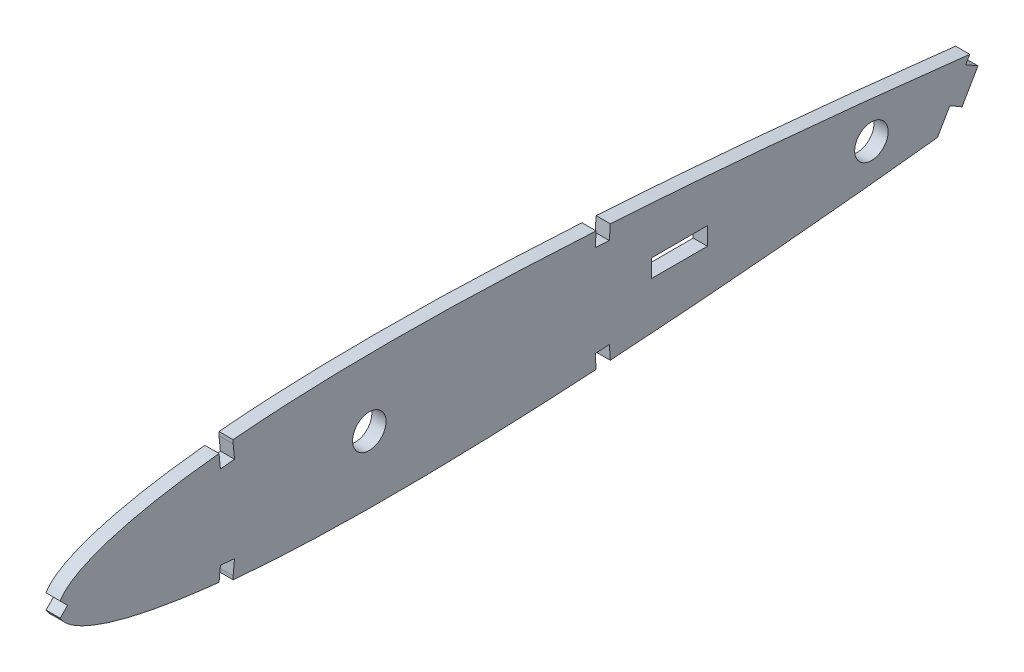
from build123d import *

# Parameters (mm, degrees)
MAIN_AIRFOIL_DEPTH               = 3.175
SPAR_HOLES_D                     = 7.5
LEADING_EDGE_SHEETING_DEPTH      = 251.46982022
LEADING_EDGE_SHEETING_DEPTH_BACK = 251.46982022
ENDPLATE_ELEVATOR_CUT_DEPTH      = 251.46982022
ENDPLATE_ELEVATOR_CUT_DEPTH_BACK = 251.46982022
STRINGERS_CUT_DEPTH              = 210.033152603
STRINGERS_CUT_DEPTH_BACK         = 210.033152603
SERVO_WIRE_CUT_DEPTH             = 208.449962387
SERVO_WIRE_CUT_DEPTH_BACK        = 208.449962387
SKETCH12_W                       = 12.5
SKETCH12_H                       = 4


with BuildPart() as part:
    # Sketch1 → main airfoil (new body)
    with BuildSketch(Plane(origin=(0, 0, 0), x_dir=(0, 0, -1), z_dir=(1, 0, 0))):
        with BuildLine():
            add(Edge.make_bspline(
                [(250, -2e-09), (250, 0.018678284), (249.174689323, 0.093287857), (248.32446246, 0.259458763), (246.243044417, 0.533840137), (243.659362537, 0.910573958), (240.240612473, 1.384241178), (236.150430611, 1.945886269), (231.361161707, 2.586906774), (225.920856641, 3.297863303), (219.856797124, 4.06796415), (213.208366153, 4.885916807), (206.016018791, 5.741913973), (198.324180408, 6.62406412), (190.180187635, 7.520784501), (181.634404857, 8.421582341), (172.739445771, 9.314517476), (163.550215709, 10.187513224), (154.123274492, 11.028891603), (144.516832181, 11.82466947), (134.789982601, 12.562946799), (125.002727118, 13.229618159), (115.215358592, 13.810721438), (105.48818759, 14.29294213), (95.881251181, 14.663216165), (86.453504035, 14.909617829), (77.263215674, 15.020341748), (68.366854268, 14.987626073), (59.81926941, 14.804121641), (51.673066268, 14.465801182), (43.978409925, 13.97145626), (36.782541712, 13.323205499), (30.129564021, 12.525445662), (24.059974529, 11.585520991), (18.610573434, 10.513116535), (13.813297521, 9.320389204), (9.695407656, 8.018962504), (6.277825273, 6.620958993), (3.57144917, 5.13583648), (1.580443808, 3.560663864), (0.305221072, 1.857334126), (-0.142243872, 0), (0.305221072, -1.857334126), (1.580443808, -3.560663864), (3.57144917, -5.13583648), (6.277825273, -6.620958993), (9.695407656, -8.018962504), (13.813297521, -9.320389204), (18.610573434, -10.513116535), (24.059974528, -11.585520991), (30.129564021, -12.525445662), (36.782541712, -13.3232055), (43.978409924, -13.97145626), (51.673066268, -14.465801183), (59.81926941, -14.804121642), (68.366854268, -14.987626074), (77.263215673, -15.020341748), (86.453504035, -14.90961783), (95.881251181, -14.663216166), (105.48818759, -14.292942132), (115.215358592, -13.810721439), (125.002727117, -13.229618161), (134.789982601, -12.562946801), (144.516832181, -11.824669472), (154.123274492, -11.028891605), (163.550215709, -10.187513226), (172.73944577, -9.314517478), (181.634404857, -8.421582343), (190.180187634, -7.520784503), (198.324180408, -6.624064123), (206.016018791, -5.741913976), (213.208366153, -4.88591681), (219.856797124, -4.067964152), (225.920856641, -3.297863306), (231.361161707, -2.586906777), (236.150430611, -1.945886272), (240.240612473, -1.384241181), (243.659362537, -0.910573961), (246.243044417, -0.53384014), (248.32446246, -0.259458766), (249.174689323, -0.09328786), (250, -0.018678287), (250, -2e-09)],
                knots=[0, 0, 0, 0, 0.000763607, 0.003050195, 0.006844435, 0.012122612, 0.018850497, 0.026986066, 0.036476947, 0.047263893, 0.059278171, 0.072445234, 0.086681978, 0.101899794, 0.118004328, 0.134894608, 0.152465716, 0.170609402, 0.189211673, 0.208158561, 0.227331554, 0.24661328, 0.265884303, 0.285025762, 0.303921916, 0.322456848, 0.340520504, 0.358003941, 0.374805255, 0.390827224, 0.405977835, 0.420173298, 0.433337329, 0.445401027, 0.456307113, 0.466008503, 0.474475471, 0.481698721, 0.48770537, 0.492584414, 0.496544073, 0.5, 0.503455927, 0.507415586, 0.51229463, 0.518301279, 0.525524529, 0.533991497, 0.543692887, 0.554598973, 0.566662671, 0.579826702, 0.594022165, 0.609172776, 0.625194745, 0.641996059, 0.659479496, 0.677543152, 0.696078084, 0.714974238, 0.734115697, 0.75338672, 0.772668446, 0.791841439, 0.810788327, 0.829390598, 0.847534284, 0.865105392, 0.881995672, 0.898100206, 0.913318022, 0.927554766, 0.940721829, 0.952736107, 0.963523053, 0.973013934, 0.981149503, 0.987877388, 0.993155565, 0.996949805, 0.999236393, 1, 1, 1, 1], degree=3))
        make_face()
    extrude(amount=MAIN_AIRFOIL_DEPTH)

    # spar holes (through all)
    with Locations(Plane(origin=(0, 0, 0), x_dir=(0, 0, -1), z_dir=(-1, 0, 0))):
        with Locations((70.5, 0), (183, 0)):
            Hole(SPAR_HOLES_D / 2)

    # Sketch6 → leading edge sheeting (cut, two sides: drawn at the far end of the back side and taken through both)
    with BuildSketch(Plane(origin=(0, 0, 0), x_dir=(0, 0, -1), z_dir=(1, 0, 0)).offset(-LEADING_EDGE_SHEETING_DEPTH_BACK)):
        with BuildLine():
            Line((40, 12.807355199), (40, 13.604416608))
            add(Edge.make_bspline(
                [(40, 13.604416608), (38.869847951, 13.500847876), (35.513913522, 13.171084048), (30.129564021, 12.525445662), (24.059974529, 11.585520991), (18.610573434, 10.513116535), (13.813297521, 9.320389204), (9.695407656, 8.018962504), (6.277825273, 6.620958993), (3.57144917, 5.13583648), (1.580443808, 3.560663864), (0.305221072, 1.857334126), (-0.142243872, 0), (0.305221072, -1.857334126), (1.580443808, -3.560663864), (3.57144917, -5.13583648), (6.277825273, -6.620958993), (9.695407656, -8.018962504), (13.813297521, -9.320389204), (18.610573434, -10.513116535), (24.059974528, -11.585520991), (30.129564021, -12.525445662), (35.513913522, -13.171084049), (38.869847951, -13.500847877), (40, -13.604416608)],
                knots=[0.413495277, 0.413495277, 0.413495277, 0.413495277, 0.420173298, 0.433337329, 0.445401027, 0.456307113, 0.466008503, 0.474475471, 0.481698721, 0.48770537, 0.492584414, 0.496544073, 0.5, 0.503455927, 0.507415586, 0.51229463, 0.518301279, 0.525524529, 0.533991497, 0.543692887, 0.554598973, 0.566662671, 0.579826702, 0.586504723, 0.586504723, 0.586504723, 0.586504723], degree=3))
            Line((40, -13.604416608), (40, -12.807355199))
            add(Edge.make_bspline(
                [(40, 12.807355199), (37.780060227, 12.603336944), (32.480475857, 12.046953916), (25.675735913, 11.073549093), (19.603802696, 9.905628586), (15.097706964, 8.844054398), (10.674365466, 7.532916953), (7.111963321, 6.138793478), (4.45362056, 4.719277098), (2.641930959, 3.442374832), (1.188772611, 1.866891991), (0.596238695, 0), (1.188772611, -1.866891991), (2.641930959, -3.442374832), (4.45362056, -4.719277098), (7.111963321, -6.138793478), (10.674365466, -7.532916953), (15.097706964, -8.844054398), (19.603802696, -9.905628586), (25.675735913, -11.073549093), (32.480475857, -12.046953916), (37.780060227, -12.603336944), (40, -12.807355199)],
                knots=[0.413638357, 0.413638357, 0.413638357, 0.413638357, 0.426796419, 0.445097314, 0.454247762, 0.46339821, 0.472548657, 0.481699105, 0.486274329, 0.490849552, 0.495424776, 0.5, 0.504575224, 0.509150448, 0.513725671, 0.518300895, 0.527451343, 0.53660179, 0.545752238, 0.554902686, 0.573203581, 0.586361643, 0.586361643, 0.586361643, 0.586361643], degree=3))
        make_face()
    extrude(amount=LEADING_EDGE_SHEETING_DEPTH + LEADING_EDGE_SHEETING_DEPTH_BACK, mode=Mode.SUBTRACT)

    # Sketch5 → endplate elevator cut (cut, two sides: drawn at the far end of the back side and taken through both)
    with BuildSketch(Plane(origin=(0, 0, 0), x_dir=(0, 0, -1), z_dir=(1, 0, 0)).offset(-ENDPLATE_ELEVATOR_CUT_DEPTH_BACK)):
        Polygon((209.150369343, 6.626585949), (201.726255621, -6.232356218), (201.726255621, -23.257370884), (308.705498093, -23.257370884), (308.705498093, 11.775498724), (209.150369343, 11.775498724), align=None)
    extrude(amount=ENDPLATE_ELEVATOR_CUT_DEPTH + ENDPLATE_ELEVATOR_CUT_DEPTH_BACK, mode=Mode.SUBTRACT)

    # Sketch7 → stringers cut (cut, two sides: drawn at the far end of the back side and taken through both)
    with BuildSketch(Plane(origin=(0, 0, 0), x_dir=(0, 0, -1), z_dir=(1, 0, 0)).offset(-STRINGERS_CUT_DEPTH_BACK)):
        Polygon((2.907690166, 0), (0.662626136, 2.24506403), (-1.582437894, 0), (0.662626136, -2.24506403), align=None)
        Polygon((40.310651703, 9.647589302), (39.689348297, 15.967121095), (36.529582401, 15.656469392), (37.150885807, 9.336937599), align=None)
        Polygon((37.150885807, -9.3369376), (36.529582401, -15.656469392), (39.689348297, -15.967121095), (40.310651703, -9.647589303), align=None)
        Polygon((121.517319666, 16.612805314), (121.125348927, 10.274914581), (124.294294293, 10.078929211), (124.686265033, 16.416819944), align=None)
        Polygon((207.307838534, 9.785228973), (204.132838534, 4.285967659), (206.882469191, 2.698467659), (210.057469191, 8.197728973), align=None)
        Polygon((200.564124964, -1.895225561), (197.389124964, -7.394486875), (200.138755621, -8.981986875), (203.313755621, -3.482725561), align=None)
        Polygon((121.125348927, -10.274914582), (121.517319666, -16.612805315), (124.686265033, -16.416819945), (124.294294293, -10.078929213), align=None)
    extrude(amount=STRINGERS_CUT_DEPTH + STRINGERS_CUT_DEPTH_BACK, mode=Mode.SUBTRACT)

    # Sketch12 → servo wire cut (cut, two sides: drawn at the far end of the back side and taken through both)
    with BuildSketch(Plane(origin=(0, 0, 0), x_dir=(0, 0, -1), z_dir=(1, 0, 0)).offset(-SERVO_WIRE_CUT_DEPTH_BACK)):
        with Locations((140, 0)):
            Rectangle(SKETCH12_W, SKETCH12_H)
    extrude(amount=SERVO_WIRE_CUT_DEPTH + SERVO_WIRE_CUT_DEPTH_BACK, mode=Mode.SUBTRACT)


solid = part.part
